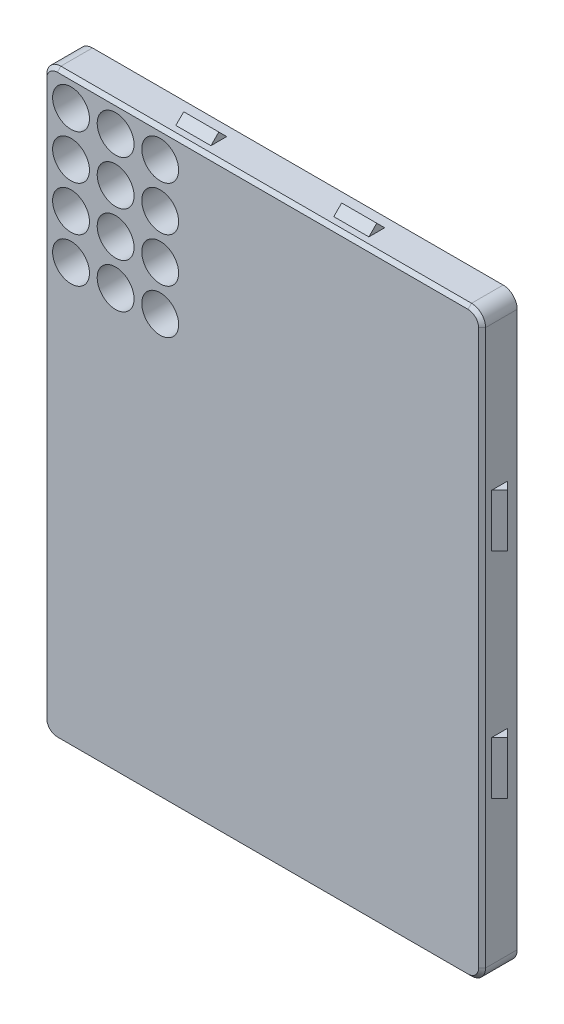
from build123d import *

# Parameters (mm, degrees)
SKETCH_1_W               = 25
SKETCH_1_H               = 33.2
EXTRUDE_1_DEPTH          = 2
FILLET_1_R               = 0.8
CHAMFER_1_SIZE           = 0.2
SKETCH_3_R               = 1.05
CUT_EXTRUDE_2_DEPTH      = 21.876062847
EXTRUDE_2_REACH          = 37.532
CUT_EXTRUDE_3_DEPTH      = 22.148581513
CUT_EXTRUDE_3_DEPTH_BACK = 22.148581513
SKETCH_5_W               = 0.45
SKETCH_5_H               = 9
SKETCH_5_H_2             = 9.2
EXTRUDE_START            = -25
EXTRUDE_3_DEPTH          = 25
CUT_EXTRUDE_4_DEPTH      = 22.503604349
CUT_EXTRUDE_4_DEPTH_BACK = 22.503604349
SKETCH_7_W               = 7
SKETCH_7_H               = 0.45


with BuildPart() as part:
    # 草图1 → 凸台-拉伸1 (new body)
    with BuildSketch(Plane.XY):
        Rectangle(SKETCH_1_W, SKETCH_1_H)
    extrude(amount=EXTRUDE_1_DEPTH)

    # 圆角1
    fillet_1_edges = [part.edges().sort_by_distance(p)[0] for p in [
        (-12.5, 16.6, 1),
        (12.5, 16.6, 1),
        (12.5, -16.6, 1),
        (-12.5, -16.6, 1),
    ]]
    fillet(fillet_1_edges, radius=FILLET_1_R)

    # 倒角1
    chamfer_1_edges = [part.edges().sort_by_distance(p)[0] for p in [
        (12.5, 0, 2),
        (0, -16.6, 2),
        (-12.5, 0, 2),
        (0, 16.6, 2),
        (12.265685425, 16.365685425, 2),
        (-12.265685425, 16.365685425, 2),
        (-12.265685425, -16.365685425, 2),
        (12.265685425, -16.365685425, 2),
    ]]
    chamfer(chamfer_1_edges, length=CHAMFER_1_SIZE)

    # 草图3 → 切除-拉伸2 (cut, through all)
    with BuildSketch(Plane(origin=(0, 0, 0), x_dir=(-1, 0, 0), z_dir=(0, 0, -1))):
        with Locations((10.92, 15.02)):
            Circle(SKETCH_3_R)
        with Locations((8.38, 15.02)):
            Circle(SKETCH_3_R)
        with Locations((5.84, 15.02)):
            Circle(SKETCH_3_R)
        with Locations((8.38, 12.48)):
            Circle(SKETCH_3_R)
        with Locations((5.84, 12.48)):
            Circle(SKETCH_3_R)
        with Locations((8.38, 9.94)):
            Circle(SKETCH_3_R)
        with Locations((5.84, 9.94)):
            Circle(SKETCH_3_R)
        with Locations((8.38, 7.4)):
            Circle(SKETCH_3_R)
        with Locations((5.84, 7.4)):
            Circle(SKETCH_3_R)
        with Locations((10.92, 12.48)):
            Circle(SKETCH_3_R)
        with Locations((10.92, 9.94)):
            Circle(SKETCH_3_R)
        with Locations((10.92, 7.4)):
            Circle(SKETCH_3_R)
    extrude(amount=-CUT_EXTRUDE_2_DEPTH, mode=Mode.SUBTRACT)

    # 凸台-拉伸2: up to this face of the body (flat: up to its plane)
    extrude_2_end = Plane(part.part.faces().sort_by_distance((0, 16.6, 0.9))[0])
    # 草图4 → 凸台-拉伸2 (add, up to the picked face)
    with BuildSketch(Plane.XZ.offset(16.6), mode=Mode.PRIVATE) as extrude_2_sk1:
        Polygon((12.5, 1.45), (12.95, 1), (12.5, 0.55), align=None)
    extrude_2_tool1 = split(extrude(extrude_2_sk1.sketch, amount=-EXTRUDE_2_REACH, mode=Mode.PRIVATE), bisect_by=extrude_2_end, keep=Keep.BOTH, mode=Mode.PRIVATE)
    # 草图4 → 凸台-拉伸2 (add, up to the picked face)
    with BuildSketch(Plane.XZ.offset(16.6), mode=Mode.PRIVATE) as extrude_2_sk2:
        Polygon((-12.5, 1.45), (-12.95, 1), (-12.5, 0.55), align=None)
    extrude_2_tool2 = split(extrude(extrude_2_sk2.sketch, amount=-EXTRUDE_2_REACH, mode=Mode.PRIVATE), bisect_by=extrude_2_end, keep=Keep.BOTH, mode=Mode.PRIVATE)
    add(extrude_2_tool1.solids().sort_by(Axis((12.65, -16.6, 1), (0, 1, 0)))[0])
    add(extrude_2_tool2.solids().sort_by(Axis((-12.65, -16.6, 1), (0, 1, 0)))[0])

    # 草图5 → 切除-拉伸3 (cut, two sides: drawn at the far end of the back side and taken through both)
    with BuildSketch(Plane.XY.offset(2).offset(-CUT_EXTRUDE_3_DEPTH_BACK)):
        with Locations((-12.725, 12.1)):
            Rectangle(SKETCH_5_W, SKETCH_5_H)
        with Locations((-12.725, 0)):
            Rectangle(SKETCH_5_W, SKETCH_5_H_2)
        with Locations((-12.725, -12.1)):
            Rectangle(SKETCH_5_W, SKETCH_5_H)
        with Locations((12.725, -12.1)):
            Rectangle(SKETCH_5_W, SKETCH_5_H)
        with Locations((12.725, 0)):
            Rectangle(SKETCH_5_W, SKETCH_5_H_2)
        with Locations((12.725, 12.1)):
            Rectangle(SKETCH_5_W, SKETCH_5_H)
    extrude(amount=CUT_EXTRUDE_3_DEPTH + CUT_EXTRUDE_3_DEPTH_BACK, mode=Mode.SUBTRACT)

    # 草图6 → 凸台-拉伸3 (add)
    with BuildSketch(Plane(origin=(12.5, 0, 0), x_dir=(0, 0, -1), z_dir=(1, 0, 0)).offset(EXTRUDE_START)):
        Polygon((-1.45, 16.6), (-0.55, 16.6), (-1, 17.05), align=None)
        Polygon((-0.55, -16.6), (-1, -17.05), (-1.45, -16.6), align=None)
    extrude(amount=EXTRUDE_3_DEPTH)

    # 草图7 → 切除-拉伸4 (cut, two sides: drawn at the far end of the back side and taken through both)
    with BuildSketch(Plane.XY.offset(2).offset(-CUT_EXTRUDE_4_DEPTH_BACK)):
        with Locations((-9, 16.825)):
            Rectangle(SKETCH_7_W, SKETCH_7_H)
        with Locations((0, 16.825)):
            Rectangle(SKETCH_7_W, SKETCH_7_H)
        with Locations((9, -16.825)):
            Rectangle(SKETCH_7_W, SKETCH_7_H)
        with Locations((9, 16.825)):
            Rectangle(SKETCH_7_W, SKETCH_7_H)
        with Locations((0, -16.825)):
            Rectangle(SKETCH_7_W, SKETCH_7_H)
        with Locations((-9, -16.825)):
            Rectangle(SKETCH_7_W, SKETCH_7_H)
    extrude(amount=CUT_EXTRUDE_4_DEPTH + CUT_EXTRUDE_4_DEPTH_BACK, mode=Mode.SUBTRACT)


solid = part.part
